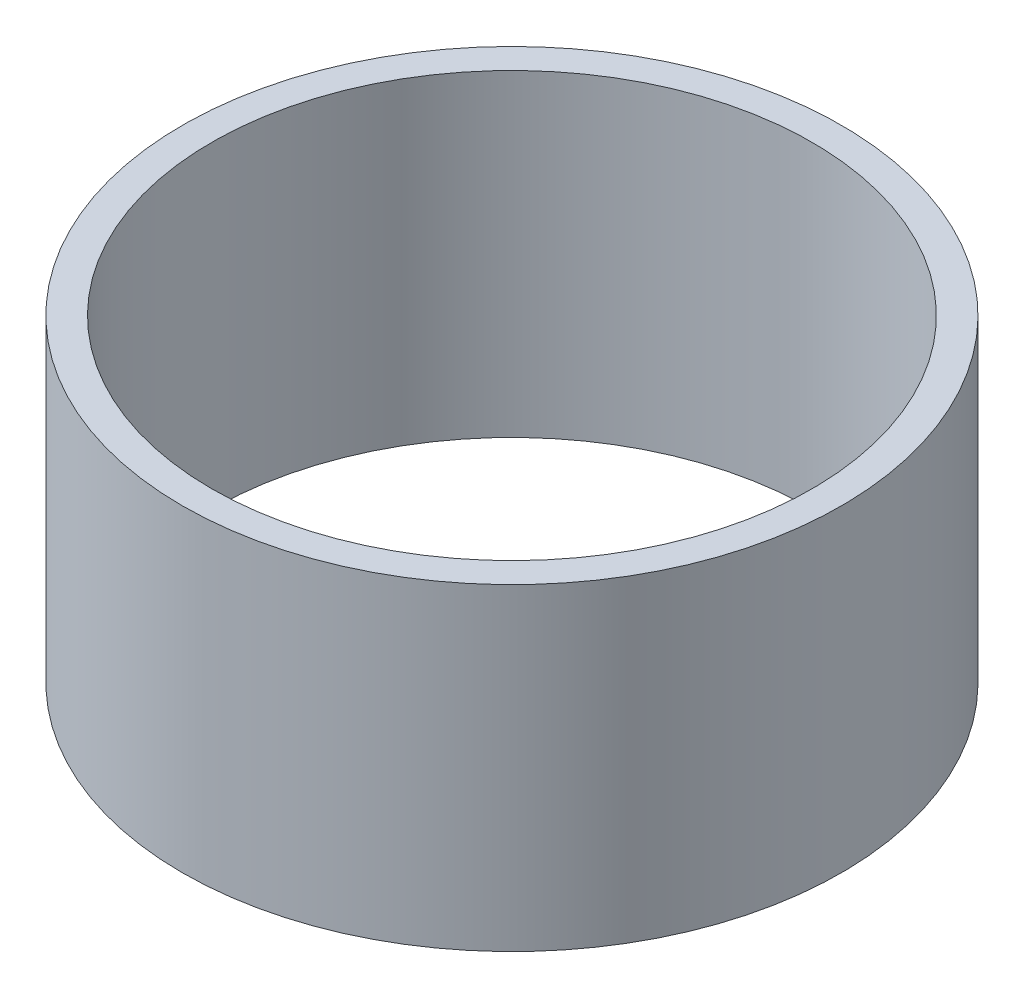
from build123d import *

# Parameters (mm, degrees)
SKETCH_1_R      = 14
SKETCH_1_R_2    = 12.75
EXTRUDE_1_DEPTH = 13.5


with BuildPart() as part:
    # 草图1 → 凸台-拉伸1 (new body)
    with BuildSketch(Plane(origin=(0, 0, 0), x_dir=(1, 0, 0), z_dir=(0, 1, 0))):
        with Locations(Location((0, 0, 0), (0, 0, 270))):
            Circle(SKETCH_1_R)
        with Locations(Location((0, 0, 0), (0, 0, 270))):
            Circle(SKETCH_1_R_2, mode=Mode.SUBTRACT)
    extrude(amount=EXTRUDE_1_DEPTH)


solid = part.part
